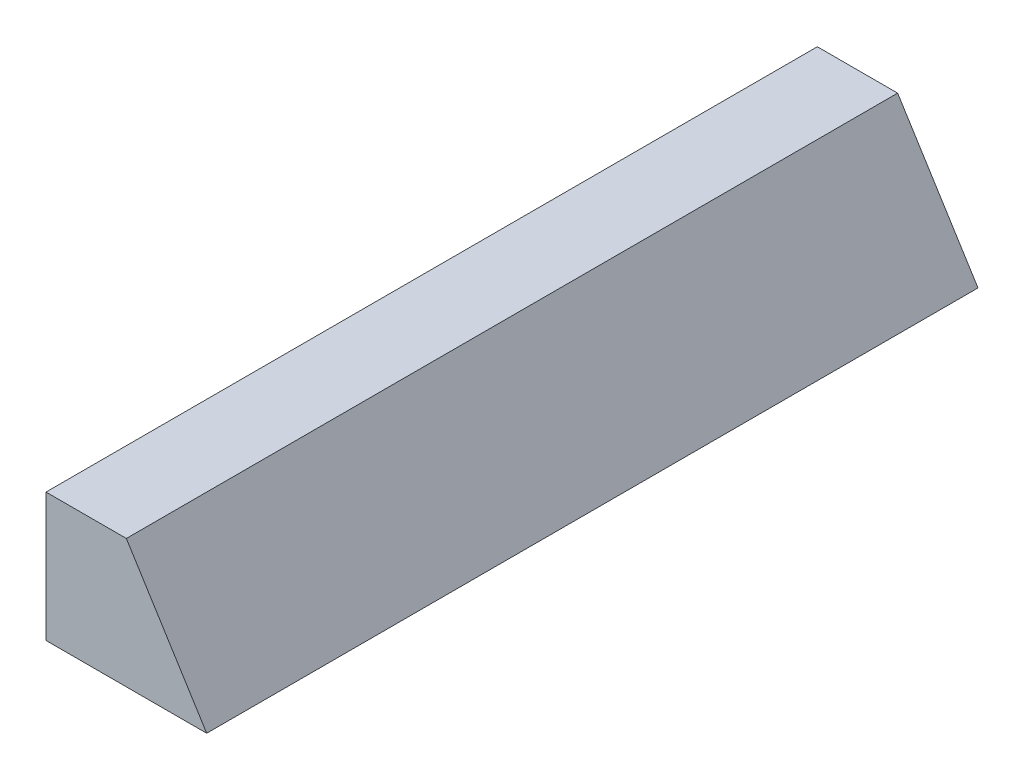
from build123d import *

# Parameters (mm, degrees)
BOSS_EXTRUDE1_DEPTH = 609.6
SHELL2_T            = -2.54


with BuildPart() as part:
    # Sketch2 → Boss-Extrude1 (new body)
    with BuildSketch(Plane.XY):
        Polygon((-52.065480427, -13.486969945), (74.934519573, -13.486969945), (11.434519573, 88.113030055), (-52.065480427, 88.113030055), (-52.065480427, 37.313030055), align=None)
    extrude(amount=BOSS_EXTRUDE1_DEPTH)

    # Shell2
    shell2_openings = [part.faces().sort_by_distance(p)[0] for p in [
        (-52.065480427, 37.313030055, 304.8),
    ]]
    offset(amount=SHELL2_T, openings=shell2_openings, kind=Kind.INTERSECTION)


solid = part.part
